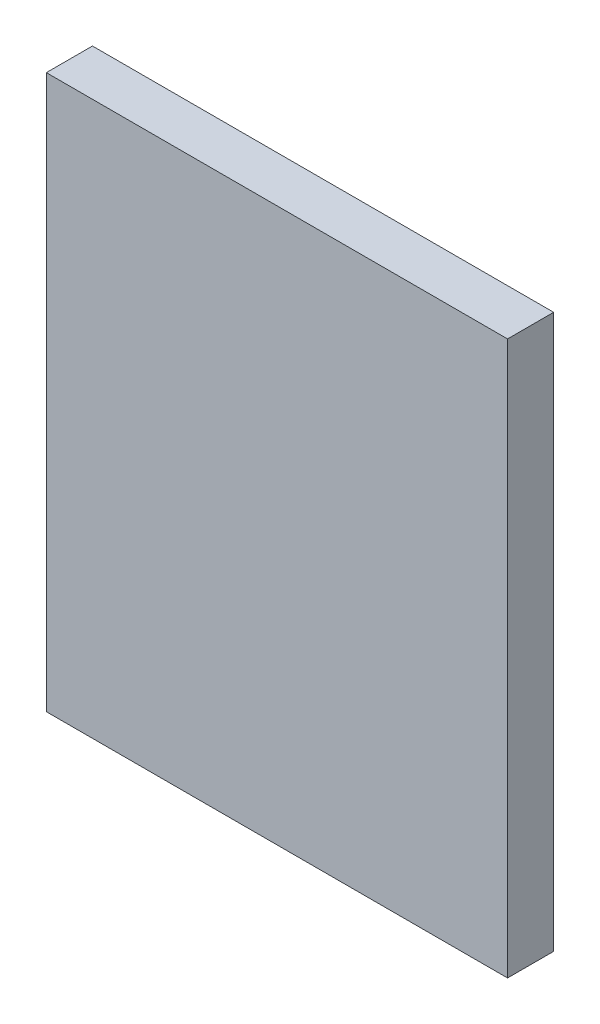
from build123d import *

# Parameters (mm, degrees)
SKETCH_1_W      = 50
SKETCH_1_H      = 60
EXTRUDE_1_DEPTH = 5


with BuildPart() as part:
    # 草图1 → 凸台-拉伸1 (new body)
    with BuildSketch(Plane.XY.offset(5)):
        with Locations((25, 30)):
            Rectangle(SKETCH_1_W, SKETCH_1_H)
    extrude(amount=-EXTRUDE_1_DEPTH)


solid = part.part
